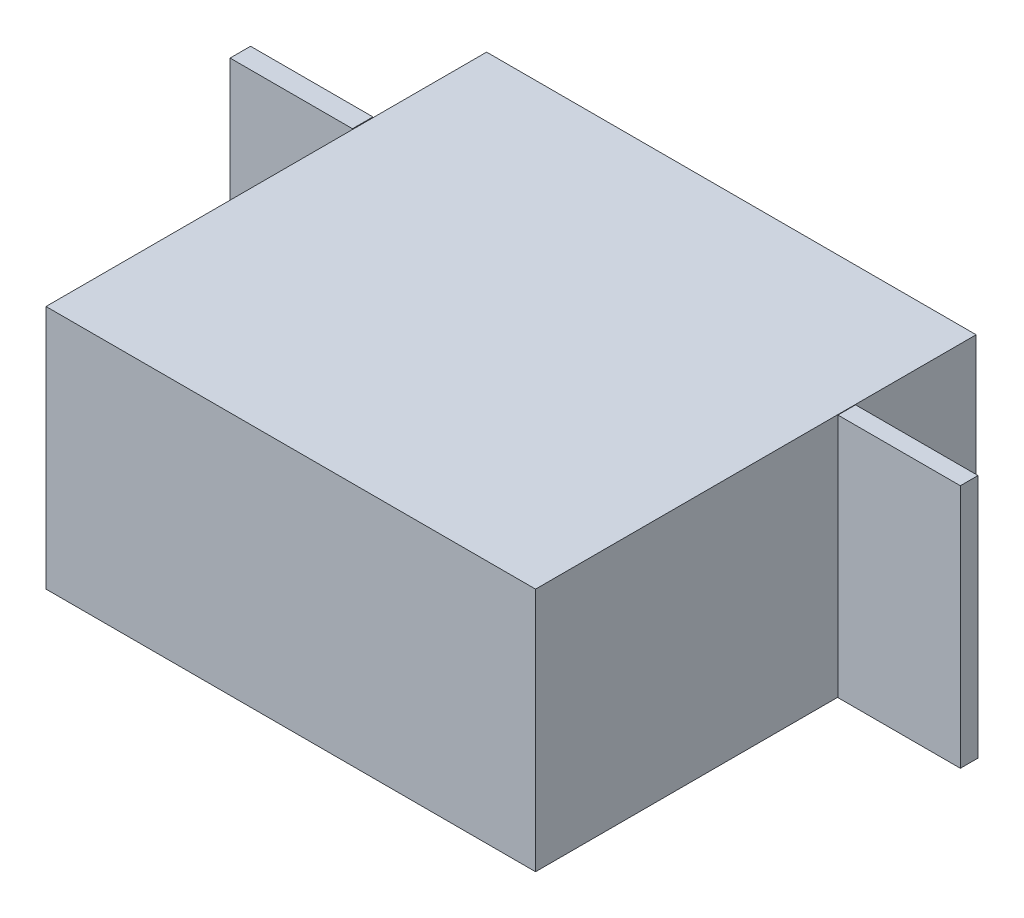
from build123d import *

# Parameters (mm, degrees)
SKETCH_1_W      = 40
SKETCH_1_H      = 20
EXTRUDE_1_DEPTH = 36
SKETCH_2_W      = 1.671860453
SKETCH_2_H      = 20
EXTRUDE_2_DEPTH = 10
SKETCH_5_W      = 1.442469022
SKETCH_5_H      = 19.996010925
EXTRUDE_5_DEPTH = 10
SKETCH_7_R      = 6.5
EXTRUDE_6_DEPTH = 2


with BuildPart() as part:
    # 草图1 → 凸台-拉伸1 (new body)
    with BuildSketch(Plane.XY):
        with Locations((-345.403508772, -241.771929825)):
            Rectangle(SKETCH_1_W, SKETCH_1_H)
    extrude(amount=-EXTRUDE_1_DEPTH)

    # 草图2 → 凸台-拉伸2 (add)
    with BuildSketch(Plane(origin=(-365.403508772, 0, -0.001996536), x_dir=(0, 0, 1), z_dir=(-1, 0, 0))):
        with Locations((-25.87591575, -241.714058127)):
            Rectangle(SKETCH_2_W, SKETCH_2_H)
    extrude(amount=EXTRUDE_2_DEPTH)

    # 草图5 → 凸台-拉伸5 (add)
    with BuildSketch(Plane(origin=(-325.403508772, 0, -0.752936531), x_dir=(0, 0, -1), z_dir=(1, 0, 0))):
        with Locations((24.676802168, -241.807464448)):
            Rectangle(SKETCH_5_W, SKETCH_5_H)
    extrude(amount=EXTRUDE_5_DEPTH)

    # 草图7 → 凸台-拉伸6 (add)
    with BuildSketch(Plane(origin=(-2.226236695, -0.840173037, -36), x_dir=(-1, 0, 0), z_dir=(0, 0, -1))):
        with Locations(Location((333.308396358, -240.749438329, 0), (0, 0, 180))):
            Circle(SKETCH_7_R)
    extrude(amount=EXTRUDE_6_DEPTH)


solid = part.part
